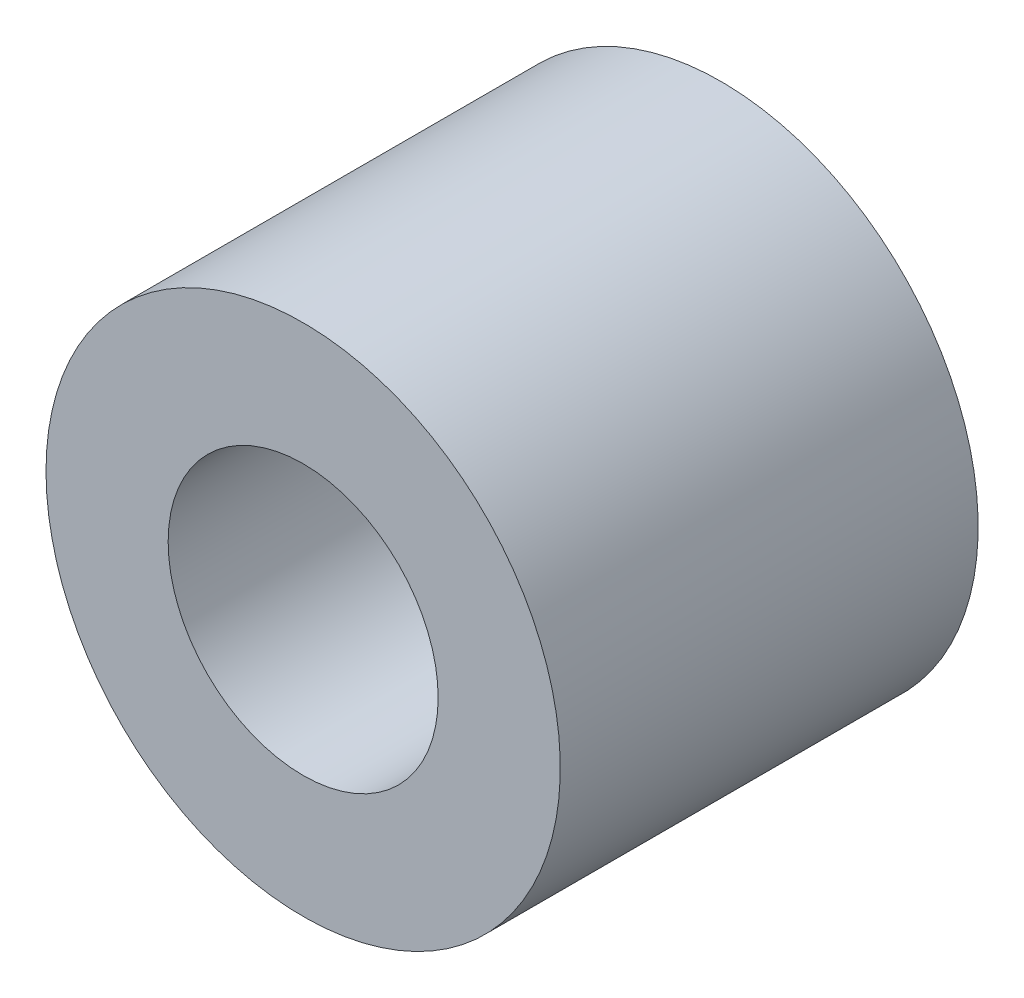
from build123d import *

# Parameters (mm, degrees)
SKETCH_1_R      = 4
SKETCH_1_R_2    = 2.1
EXTRUDE_1_DEPTH = 6.5


with BuildPart() as part:
    # ｽｹｯﾁ1 → ﾎﾞｽ - 押し出し1 (new body)
    with BuildSketch(Plane.XY):
        with Locations(Location((0, 0, 0), (0, 0, 180))):
            Circle(SKETCH_1_R)
        with Locations(Location((0, 0, 0), (0, 0, 180))):
            Circle(SKETCH_1_R_2, mode=Mode.SUBTRACT)
    extrude(amount=EXTRUDE_1_DEPTH)


solid = part.part
